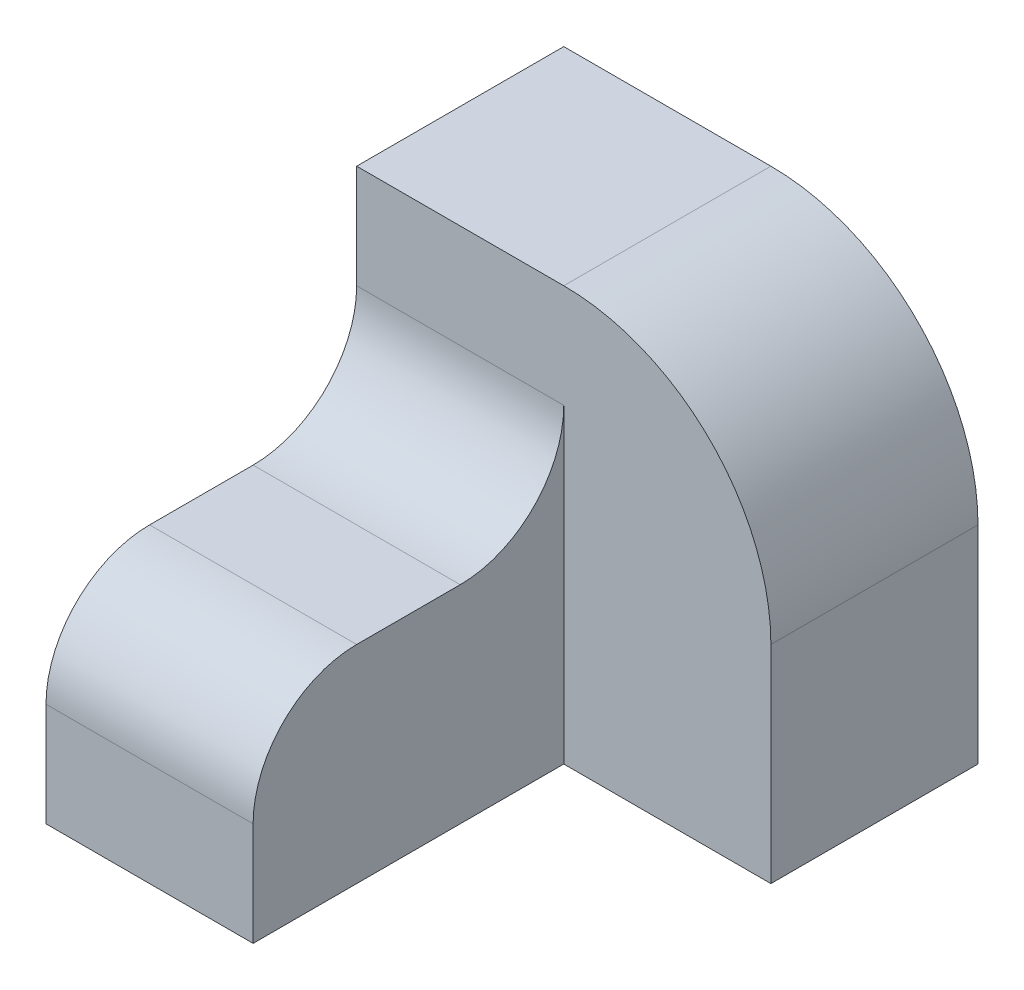
from build123d import *

# Parameters (mm, degrees)
EXTRUDE_1_DEPTH = 40
SKETCH_1_3_W    = 20
SKETCH_1_3_H    = 30
EXTRUDE_2_DEPTH = 20
FILLET_1_R      = 10
FILLET_2_R      = 20


with BuildPart() as part:
    # 草圖1 → 填料-伸長1 (new body)
    with BuildSketch(Plane(origin=(0, 0, 0), x_dir=(1, 0, 0), z_dir=(0, 1, 0))):
        Polygon((-20, 0), (0, 0), (0, 20), (-40, 20), (-40, 0), align=None)
    extrude(amount=EXTRUDE_1_DEPTH)

    # 草圖1<3> → 填料-伸長2 (add)
    with BuildSketch(Plane(origin=(0, 0, 0), x_dir=(1, 0, 0), z_dir=(0, 1, 0))):
        with Locations((-30, -15)):
            Rectangle(SKETCH_1_3_W, SKETCH_1_3_H)
    extrude(amount=EXTRUDE_2_DEPTH)

    # 圓角1
    fillet_1_edges = [part.edges().sort_by_distance(p)[0] for p in [
        (-30, 20, 0),
        (-30, 20, 30),
    ]]
    fillet(fillet_1_edges, radius=FILLET_1_R)

    # 圓角2
    fillet_2_edges = [part.edges().sort_by_distance(p)[0] for p in [
        (0, 40, -10),
    ]]
    fillet(fillet_2_edges, radius=FILLET_2_R)


solid = part.part
